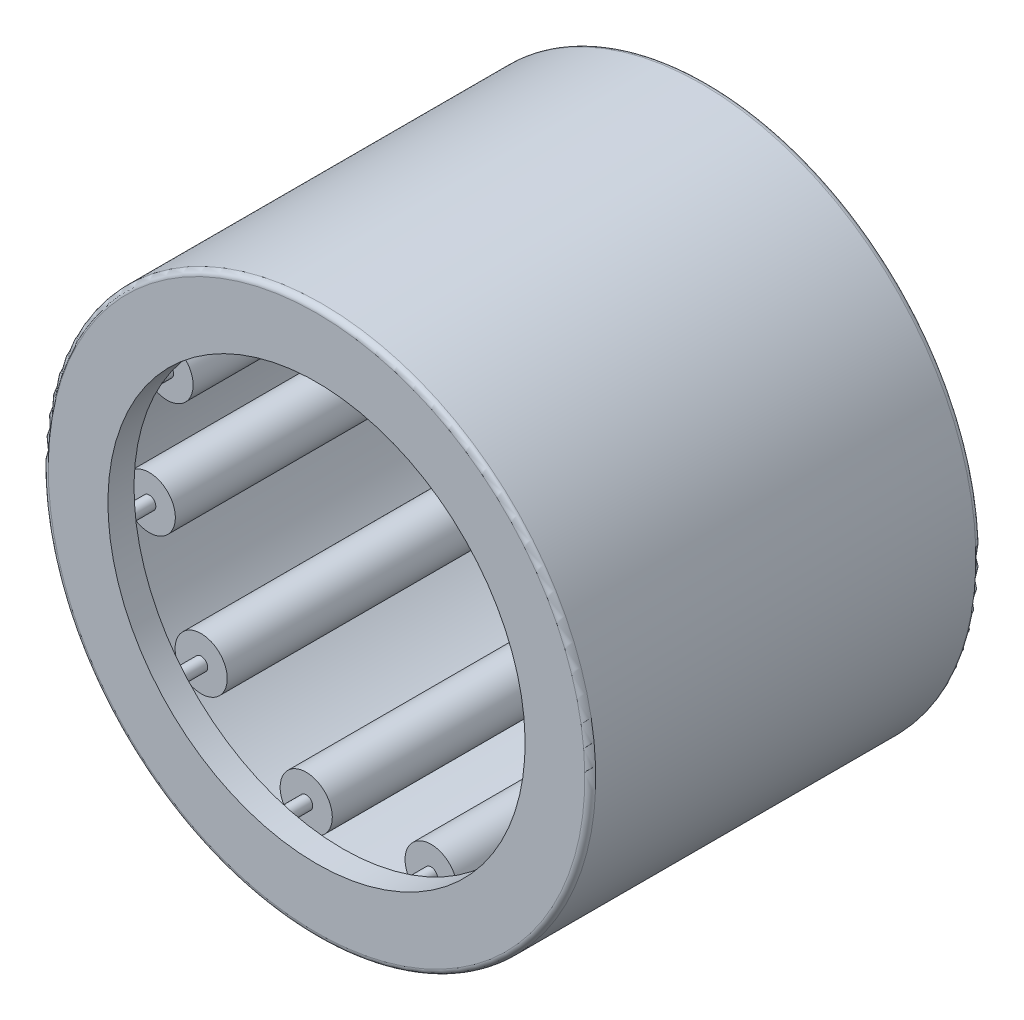
from build123d import *

# Parameters (mm, degrees)
SKETCH2_W         = 7.333333334
SKETCH2_H         = 0.5
SKETCH3_W         = 8.666666666
SKETCH3_H         = 0.166666666
CIRPATTERN1_COUNT = 11
CIRPATTERN1_ANGLE = 327.272727273
FILLET1_R         = 0.14


with BuildPart() as part:
    # Sketch7 → Revolve1 (revolve)
    with BuildSketch(Plane(origin=(0, 0, 0), x_dir=(0, 0, -1), z_dir=(1, 0, 0)), mode=Mode.PRIVATE) as revolve1_sk:
        Polygon((-5, 7), (-5, 5.333333333), (-4.333333333, 5.333333333), (-4.333333333, 6.333333333), (4.333333333, 6.333333333), (4.333333333, 5.333333333), (5, 5.333333333), (5, 7), align=None)
    revolve(revolve1_sk.sketch.rotate(Axis((0, 0, 5), (0, 0, -1)), 180), axis=Axis((0, 0, 5), (0, 0, -1)))

    # Fillet1
    fillet1_edges = [part.edges().sort_by_distance(p)[0] for p in [
        (0, 7, -5),
        (0, 7, 5),
    ]]
    fillet(fillet1_edges, radius=FILLET1_R)


with BuildPart() as body_2:
    # Sketch2 → Revolve2 (revolve)
    with BuildSketch(Plane(origin=(0, 0, 0), x_dir=(0, 0, -1), z_dir=(1, 0, 0)), mode=Mode.PRIVATE) as revolve2_sk:
        with Locations((0, 6.083333333)):
            Rectangle(SKETCH2_W, SKETCH2_H)
    revolve(revolve2_sk.sketch.rotate(Axis((0, 5.666666667, 3.666666667), (0, 0, -1)), 90), axis=Axis((0, 5.666666667, 3.666666667), (0, 0, -1)))


with BuildPart() as body_3:
    # Sketch3 → Revolve3 (revolve)
    with BuildSketch(Plane(origin=(0, 0, 0), x_dir=(0, 0, -1), z_dir=(1, 0, 0))):
        with Locations((0, 5.75)):
            Rectangle(SKETCH3_W, SKETCH3_H)
    revolve(axis=Axis((0, 5.666666667, 4.333333333), (0, 0, -1)))


with BuildPart() as cirpattern1_1:
    # CirPattern1: pattern copy
    add(body_2.part.rotate(Axis((0, 0, 5), (0, 0, -1)), 1 * CIRPATTERN1_ANGLE / (CIRPATTERN1_COUNT - 1)))


with BuildPart() as cirpattern1_2:
    # CirPattern1: pattern copy
    add(body_2.part.rotate(Axis((0, 0, 5), (0, 0, -1)), 2 * CIRPATTERN1_ANGLE / (CIRPATTERN1_COUNT - 1)))


with BuildPart() as cirpattern1_3:
    # CirPattern1: pattern copy
    add(body_2.part.rotate(Axis((0, 0, 5), (0, 0, -1)), 3 * CIRPATTERN1_ANGLE / (CIRPATTERN1_COUNT - 1)))


with BuildPart() as cirpattern1_4:
    # CirPattern1: pattern copy
    add(body_2.part.rotate(Axis((0, 0, 5), (0, 0, -1)), 4 * CIRPATTERN1_ANGLE / (CIRPATTERN1_COUNT - 1)))


with BuildPart() as cirpattern1_5:
    # CirPattern1: pattern copy
    add(body_2.part.rotate(Axis((0, 0, 5), (0, 0, -1)), 5 * CIRPATTERN1_ANGLE / (CIRPATTERN1_COUNT - 1)))


with BuildPart() as cirpattern1_6:
    # CirPattern1: pattern copy
    add(body_2.part.rotate(Axis((0, 0, 5), (0, 0, -1)), 6 * CIRPATTERN1_ANGLE / (CIRPATTERN1_COUNT - 1)))


with BuildPart() as cirpattern1_7:
    # CirPattern1: pattern copy
    add(body_2.part.rotate(Axis((0, 0, 5), (0, 0, -1)), 7 * CIRPATTERN1_ANGLE / (CIRPATTERN1_COUNT - 1)))


with BuildPart() as cirpattern1_8:
    # CirPattern1: pattern copy
    add(body_2.part.rotate(Axis((0, 0, 5), (0, 0, -1)), 8 * CIRPATTERN1_ANGLE / (CIRPATTERN1_COUNT - 1)))


with BuildPart() as cirpattern1_9:
    # CirPattern1: pattern copy
    add(body_2.part.rotate(Axis((0, 0, 5), (0, 0, -1)), 9 * CIRPATTERN1_ANGLE / (CIRPATTERN1_COUNT - 1)))


with BuildPart() as cirpattern1_10:
    # CirPattern1: pattern copy
    add(body_2.part.rotate(Axis((0, 0, 5), (0, 0, -1)), 10 * CIRPATTERN1_ANGLE / (CIRPATTERN1_COUNT - 1)))


with BuildPart() as cirpattern1_11:
    # CirPattern1: pattern copy
    add(body_3.part.rotate(Axis((0, 0, 5), (0, 0, -1)), 1 * CIRPATTERN1_ANGLE / (CIRPATTERN1_COUNT - 1)))


with BuildPart() as cirpattern1_12:
    # CirPattern1: pattern copy
    add(body_3.part.rotate(Axis((0, 0, 5), (0, 0, -1)), 2 * CIRPATTERN1_ANGLE / (CIRPATTERN1_COUNT - 1)))


with BuildPart() as cirpattern1_13:
    # CirPattern1: pattern copy
    add(body_3.part.rotate(Axis((0, 0, 5), (0, 0, -1)), 3 * CIRPATTERN1_ANGLE / (CIRPATTERN1_COUNT - 1)))


with BuildPart() as cirpattern1_14:
    # CirPattern1: pattern copy
    add(body_3.part.rotate(Axis((0, 0, 5), (0, 0, -1)), 4 * CIRPATTERN1_ANGLE / (CIRPATTERN1_COUNT - 1)))


with BuildPart() as cirpattern1_15:
    # CirPattern1: pattern copy
    add(body_3.part.rotate(Axis((0, 0, 5), (0, 0, -1)), 5 * CIRPATTERN1_ANGLE / (CIRPATTERN1_COUNT - 1)))


with BuildPart() as cirpattern1_16:
    # CirPattern1: pattern copy
    add(body_3.part.rotate(Axis((0, 0, 5), (0, 0, -1)), 6 * CIRPATTERN1_ANGLE / (CIRPATTERN1_COUNT - 1)))


with BuildPart() as cirpattern1_17:
    # CirPattern1: pattern copy
    add(body_3.part.rotate(Axis((0, 0, 5), (0, 0, -1)), 7 * CIRPATTERN1_ANGLE / (CIRPATTERN1_COUNT - 1)))


with BuildPart() as cirpattern1_18:
    # CirPattern1: pattern copy
    add(body_3.part.rotate(Axis((0, 0, 5), (0, 0, -1)), 8 * CIRPATTERN1_ANGLE / (CIRPATTERN1_COUNT - 1)))


with BuildPart() as cirpattern1_19:
    # CirPattern1: pattern copy
    add(body_3.part.rotate(Axis((0, 0, 5), (0, 0, -1)), 9 * CIRPATTERN1_ANGLE / (CIRPATTERN1_COUNT - 1)))


with BuildPart() as cirpattern1_20:
    # CirPattern1: pattern copy
    add(body_3.part.rotate(Axis((0, 0, 5), (0, 0, -1)), 10 * CIRPATTERN1_ANGLE / (CIRPATTERN1_COUNT - 1)))


solid = Compound([part.part, body_2.part, body_3.part, cirpattern1_1.part, cirpattern1_2.part, cirpattern1_3.part, cirpattern1_4.part, cirpattern1_5.part, cirpattern1_6.part, cirpattern1_7.part, cirpattern1_8.part, cirpattern1_9.part, cirpattern1_10.part, cirpattern1_11.part, cirpattern1_12.part, cirpattern1_13.part, cirpattern1_14.part, cirpattern1_15.part, cirpattern1_16.part, cirpattern1_17.part, cirpattern1_18.part, cirpattern1_19.part, cirpattern1_20.part])
